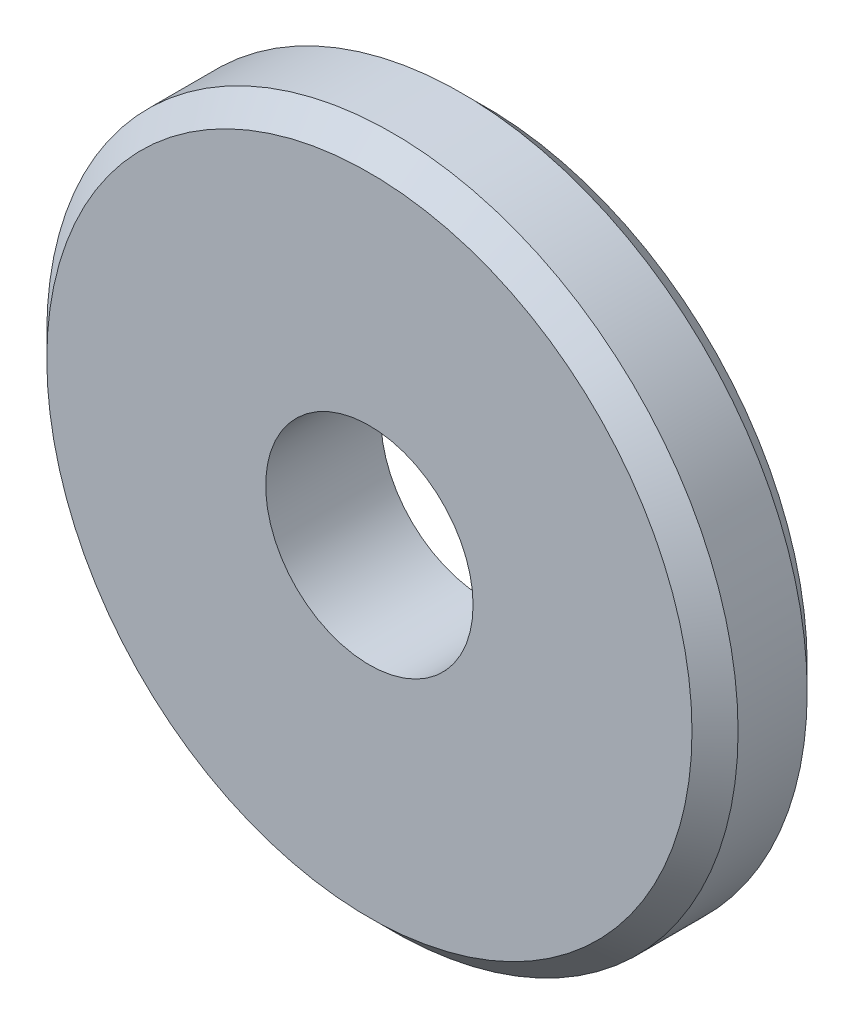
from build123d import *

# Parameters (mm, degrees)
SKETCH1_R           = 15
SKETCH1_R_2         = 4.5
BOSS_EXTRUDE1_DEPTH = 5
CHAMFER1_SIZE       = 1


with BuildPart() as part:
    # Sketch1 → Boss-Extrude1 (new body)
    with BuildSketch(Plane.XY):
        Circle(SKETCH1_R)
        Circle(SKETCH1_R_2, mode=Mode.SUBTRACT)
    extrude(amount=BOSS_EXTRUDE1_DEPTH)

    # Chamfer1
    chamfer1_edges = [part.edges().sort_by_distance(p)[0] for p in [
        (-15, 0, 0),
        (-15, 0, 5),
    ]]
    chamfer(chamfer1_edges, length=CHAMFER1_SIZE)


solid = part.part
